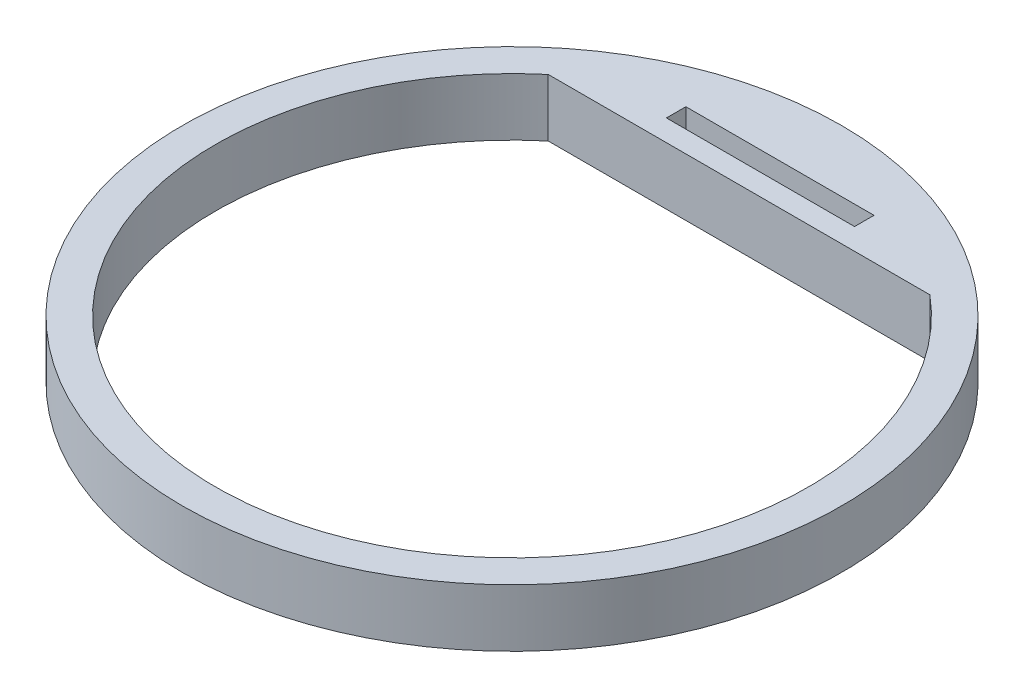
from build123d import *

# Parameters (mm, degrees)
SKETCH1_R           = 50.8
BOSS_EXTRUDE1_DEPTH = 8.89
SKETCH2_W           = 29
SKETCH2_H           = 3
CUT_EXTRUDE2_DEPTH  = 127


with BuildPart() as part:
    # Sketch1 → Boss-Extrude1 (new body)
    with BuildSketch(Plane(origin=(0, 0, 0), x_dir=(1, 0, 0), z_dir=(0, 1, 0))):
        with Locations(Location((0, 0, 0), (0, 0, 90))):
            Circle(SKETCH1_R)
        with BuildLine():
            Line((-29.416294804, 35), (29.416294804, 35))
            ThreePointArc((29.416294804, 35), (0, -45.72), (-29.416294804, 35))
        make_face(mode=Mode.SUBTRACT)
    extrude(amount=BOSS_EXTRUDE1_DEPTH)

    # Sketch2 → Cut-Extrude2 (cut)
    with BuildSketch(Plane(origin=(0, 8.89, 0), x_dir=(1, 0, 0), z_dir=(0, 1, 0))):
        with Locations((0, 39.8)):
            Rectangle(SKETCH2_W, SKETCH2_H)
    extrude(amount=-CUT_EXTRUDE2_DEPTH, mode=Mode.SUBTRACT)


solid = part.part
